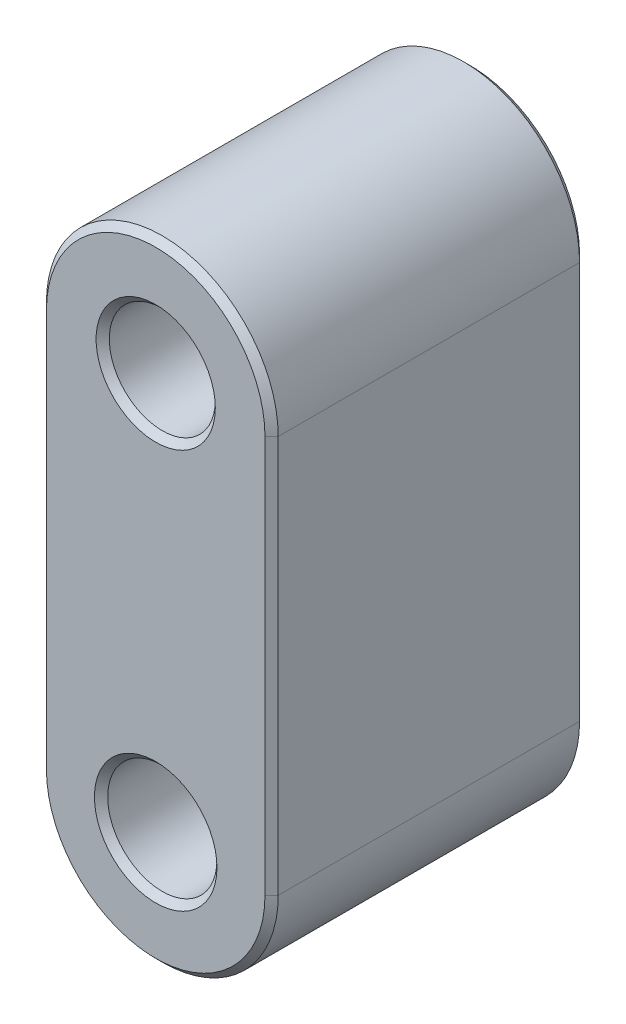
from build123d import *

# Parameters (mm, degrees)
SKETCH1_R             = 1.6
SKETCH1_R_2           = 1.65
BOSS_EXTRUDE1_DEPTH   = 4.75
DEBURS_NO_SPRING_SIZE = 0.2


with BuildPart() as part:
    # Sketch1 → Boss-Extrude1 (new, symmetric)
    with BuildSketch(Plane.XY):
        with BuildLine():
            Line((-3.5, 0), (-3.5, -12))
            ThreePointArc((-3.5, -12), (0, -15.5), (3.5, -12))
            Line((3.5, -12), (3.5, 0))
            ThreePointArc((3.5, 0), (0, 3.5), (-3.5, 0))
        make_face()
        Circle(SKETCH1_R, mode=Mode.SUBTRACT)
        with Locations((0, -12)):
            Circle(SKETCH1_R_2, mode=Mode.SUBTRACT)
    extrude(amount=BOSS_EXTRUDE1_DEPTH, both=True)

    # Deburs no Spring
    deburs_no_spring_edges = [part.edges().sort_by_distance(p)[0] for p in [
        (-1.65, -12, -4.75),
        (-1.6, 0, -4.75),
        (-1.65, -12, 4.75),
        (-3.5, -6, 4.75),
        (0, -15.5, 4.75),
        (3.5, -6, 4.75),
        (0, 3.5, 4.75),
        (-1.6, 0, 4.75),
        (0, 3.5, -4.75),
        (3.5, -6, -4.75),
        (0, -15.5, -4.75),
        (-3.5, -6, -4.75),
    ]]
    chamfer(deburs_no_spring_edges, length=DEBURS_NO_SPRING_SIZE)


solid = part.part
